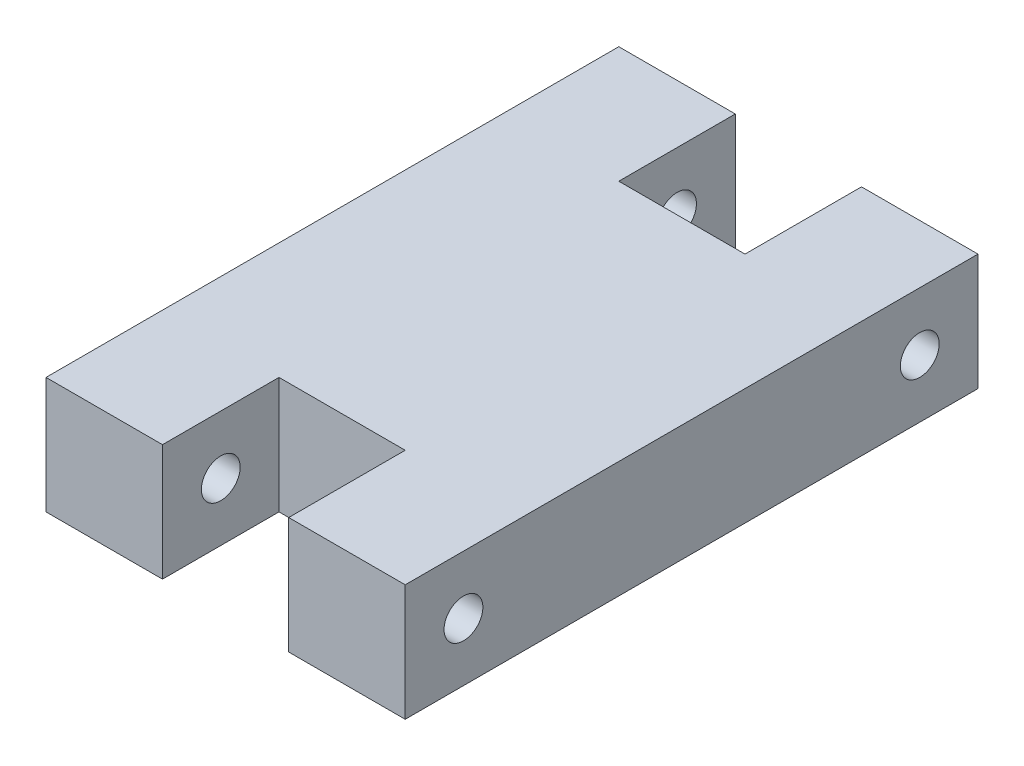
from build123d import *

# Parameters (mm, degrees)
SKETCH1_W           = 37
SKETCH1_H           = 59
BOSS_EXTRUDE1_DEPTH = 12
CUT_EXTRUDE1_REACH  = 38.831
SKETCH2_W           = 13
SKETCH2_H           = 12
CUT_EXTRUDE2_REACH  = 50.819
SKETCH3_R           = 2


with BuildPart() as part:
    # Sketch1 → Boss-Extrude1 (new body)
    with BuildSketch(Plane(origin=(0, 0, 0), x_dir=(1, 0, 0), z_dir=(0, 1, 0))):
        Rectangle(SKETCH1_W, SKETCH1_H)
    extrude(amount=BOSS_EXTRUDE1_DEPTH)

    # Sketch2 → Cut-Extrude1 (cut, up to next)
    with BuildSketch(Plane(origin=(0, 12, 0), x_dir=(1, 0, 0), z_dir=(0, 1, 0)), mode=Mode.PRIVATE) as cut_extrude1_sk1:
        with Locations((0, 23.5)):
            Rectangle(SKETCH2_W, SKETCH2_H)
    cut_extrude1_tool1 = extrude(cut_extrude1_sk1.sketch, amount=-CUT_EXTRUDE1_REACH, mode=Mode.PRIVATE) & part.part
    # Sketch2 → Cut-Extrude1 (cut, up to next)
    with BuildSketch(Plane(origin=(0, 12, 0), x_dir=(1, 0, 0), z_dir=(0, 1, 0)), mode=Mode.PRIVATE) as cut_extrude1_sk2:
        with Locations((0, -23.5)):
            Rectangle(SKETCH2_W, SKETCH2_H)
    cut_extrude1_tool2 = extrude(cut_extrude1_sk2.sketch, amount=-CUT_EXTRUDE1_REACH, mode=Mode.PRIVATE) & part.part
    add(cut_extrude1_tool1.solids().sort_by_distance((0, 12, -23.5))[0], mode=Mode.SUBTRACT)
    add(cut_extrude1_tool2.solids().sort_by_distance((0, 12, 23.5))[0], mode=Mode.SUBTRACT)

    # Cut-Extrude2: up to this face of the body (flat: up to its plane)
    cut_extrude2_end = Plane(part.part.faces().sort_by_distance((18.5, 6, 0))[0])
    # Sketch3 → Cut-Extrude2 (cut, up to the picked face)
    with BuildSketch(Plane.ZY.offset(18.5), mode=Mode.PRIVATE) as cut_extrude2_sk1:
        with Locations((-23.5, 6)):
            Circle(SKETCH3_R)
    cut_extrude2_tool1 = split(extrude(cut_extrude2_sk1.sketch, amount=-CUT_EXTRUDE2_REACH, mode=Mode.PRIVATE), bisect_by=cut_extrude2_end, keep=Keep.BOTH, mode=Mode.PRIVATE)
    cut_extrude2 = cut_extrude2_tool1.solids().sort_by(Axis((-18.5, 6, -23.5), (1, 0, 0)))[0]
    add(cut_extrude2, mode=Mode.SUBTRACT)

    # Mirror1: Cut-Extrude2 across plane
    add(cut_extrude2.mirror(Plane.XY), mode=Mode.SUBTRACT)


solid = part.part
